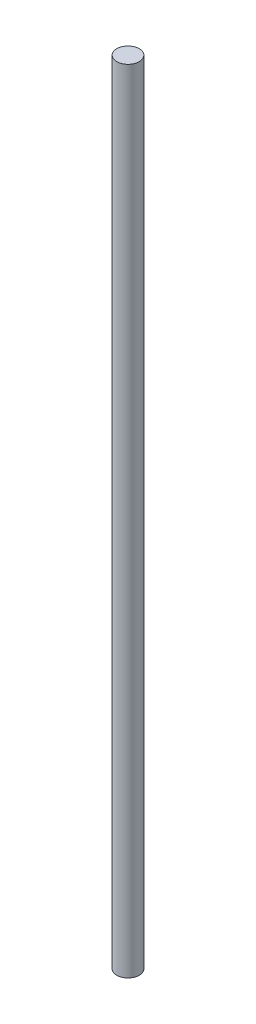
from build123d import *

# Parameters (mm, degrees)
CROQUIS1_R              = 6
SALIENTE_EXTRUIR1_DEPTH = 423


with BuildPart() as part:
    # Croquis1 → Saliente-Extruir1 (new body)
    with BuildSketch(Plane(origin=(0, 0, 0), x_dir=(1, 0, 0), z_dir=(0, 1, 0))):
        with Locations(Location((0, 0, 0), (0, 0, 90))):
            Circle(CROQUIS1_R)
    extrude(amount=SALIENTE_EXTRUIR1_DEPTH)


solid = part.part
